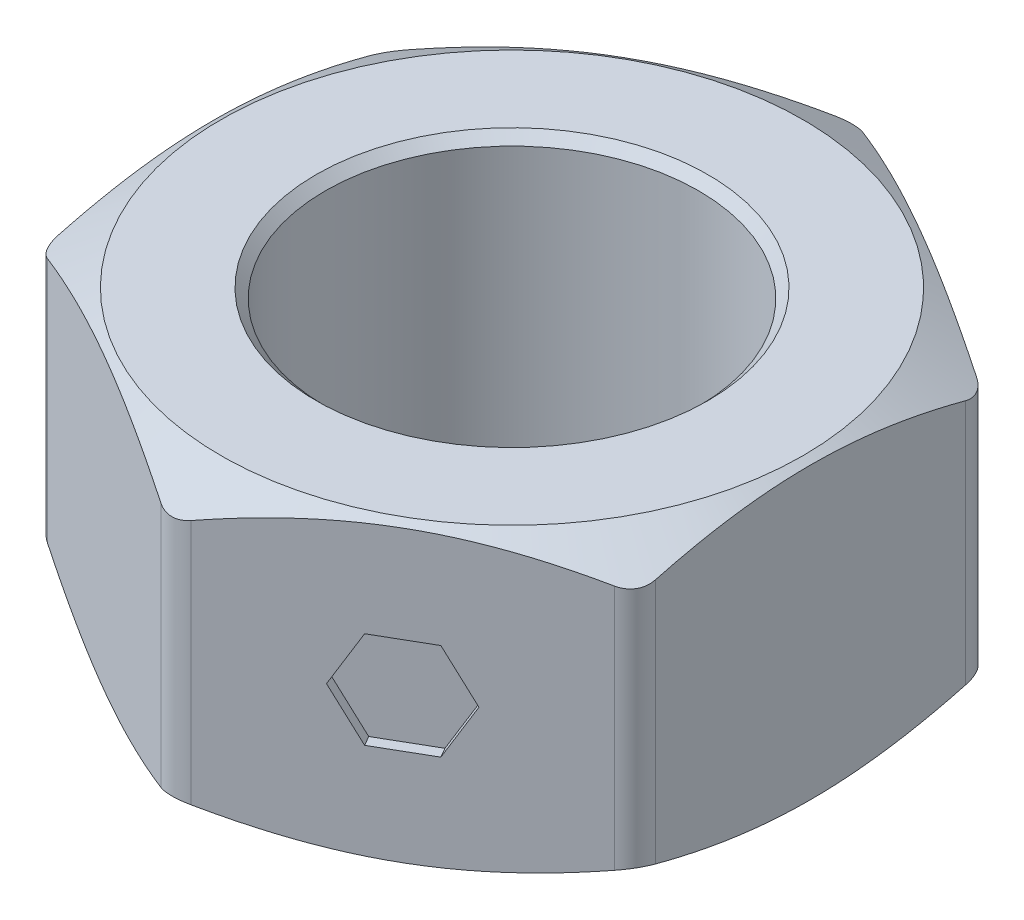
from build123d import *

# Parameters (mm, degrees)
BOSS_EXTRUDE1_DEPTH      = 2
BOSS_EXTRUDE1_DEPTH_BACK = 2
SKETCH2_R                = 2.5
FILLET1_R                = 0.4
CUT_EXTRUDE2_DEPTH       = 0.15


with BuildPart() as part:
    # Sketch2 → Boss-Extrude1 (new, two sides: drawn at the far end of the back side and taken through both)
    with BuildSketch(Plane(origin=(0, 0, 0), x_dir=(1, 0, 0), z_dir=(0, 1, 0)).offset(-BOSS_EXTRUDE1_DEPTH_BACK)):
        Polygon((0, 4.618802154), (-4, 2.309401077), (-4, -2.309401077), (0, -4.618802154), (4, -2.309401077), (4, 2.309401077), align=None)
        with Locations(Location((0, 0, 0), (0, 0, 270))):
            Circle(SKETCH2_R, mode=Mode.SUBTRACT)
    extrude(amount=BOSS_EXTRUDE1_DEPTH + BOSS_EXTRUDE1_DEPTH_BACK)

    # Fillet1
    fillet1_edges = [part.edges().sort_by_distance(p)[0] for p in [
        (4, 0, -2.309401077),
        (4, 0, 2.309401077),
        (0, 0, 4.618802154),
        (-4, 0, 2.309401077),
        (-4, 0, -2.309401077),
        (0, 0, -4.618802154),
    ]]
    fillet(fillet1_edges, radius=FILLET1_R)

    # Sketch3 → Cut-Revolve2 (revolve, cut)
    with BuildSketch(Plane(origin=(0, 0, 0), x_dir=(0, 0, -1), z_dir=(1, 0, 0)), mode=Mode.PRIVATE) as cut_revolve2_sk:
        Polygon((3.9, -2), (4.618802154, -1.584999383), (4.618802154, -2), align=None)
        Polygon((2.5, 2), (2.5, 1.875), (2.625, 2), align=None)
        Polygon((2.5, -2), (2.5, -1.875), (2.625, -2), align=None)
        Polygon((3.9, 2), (4.618802154, 1.584999383), (4.618802154, 2), align=None)
    revolve(cut_revolve2_sk.sketch.rotate(Axis((0, -2, 0), (0, 1, 0)), 270), axis=Axis((0, -2, 0), (0, 1, 0)), mode=Mode.SUBTRACT)

    # Sketch12 → Cut-Extrude2 (cut)
    with BuildSketch(Plane(origin=(2, 0, 3.464101615), x_dir=(0.8660254037844384, 0, -0.5000000000000006), z_dir=(0.5000000000000006, 0, 0.8660254037844385))):
        Polygon((-0.747578096, 0), (-0.373789048, -0.647421623), (0.373789048, -0.647421623), (0.747578096, 0), (0.373789048, 0.647421623), (-0.373789048, 0.647421623), align=None)
    extrude(amount=-CUT_EXTRUDE2_DEPTH, mode=Mode.SUBTRACT)


solid = part.part
